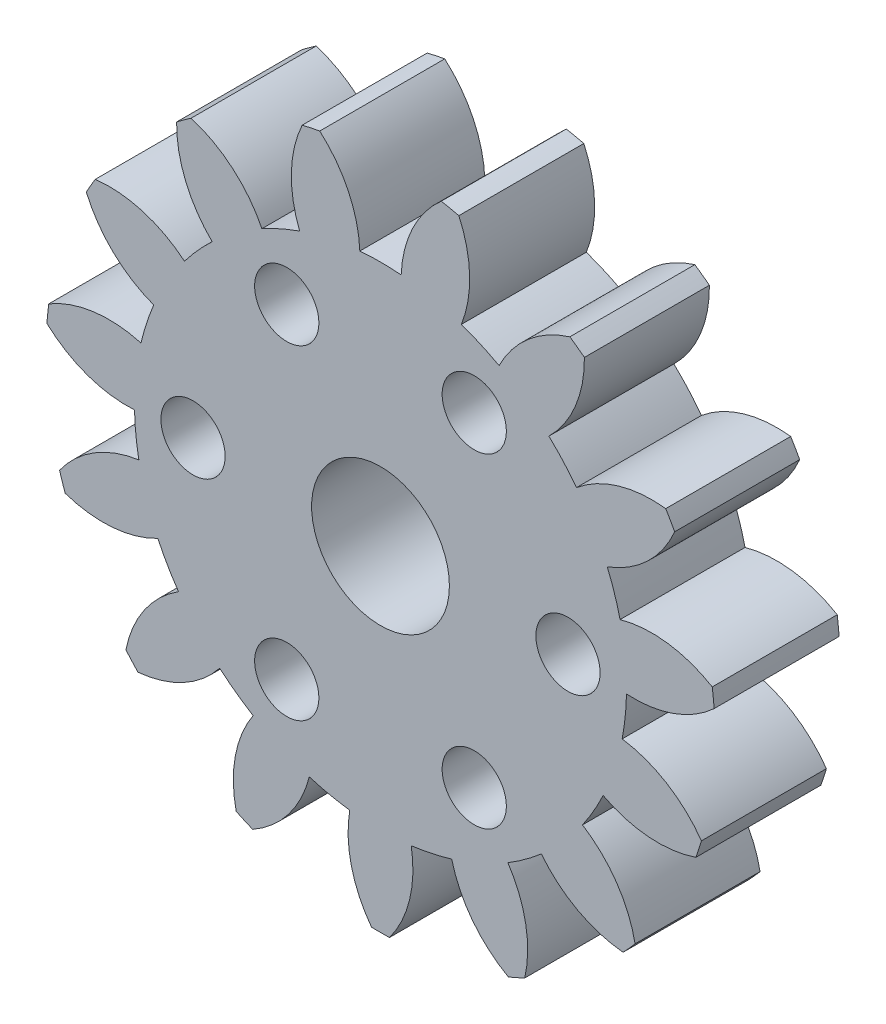
from build123d import *

# Parameters (mm, degrees)
MODEL_R             = 1.632
MODEL_R_2           = 3.5
BOSS_EXTRUDE1_DEPTH = 6.35


with BuildPart() as part:
    # Model → Boss-Extrude1 (new body)
    with BuildSketch(Plane.XY):
        with BuildLine():
            ThreePointArc((-16.948506407, 1.322168893), (-14.884445144, 0.075680968), (-12.496345641, -0.2575784))
            ThreePointArc((-12.496345641, -0.2575784), (-12.43052917, -1.306501262), (-12.276824067, -2.346186657))
            ThreePointArc((-12.276824067, -2.346186657), (-14.543449347, -3.168677314), (-16.303246508, -4.817068954))
            ThreePointArc((-16.303246508, -4.817068954), (-16.167960777, -5.253288904), (-16.021005579, -5.685717215))
            ThreePointArc((-16.021005579, -5.685717215), (-13.628399474, -5.984911247), (-11.311213223, -5.318031254))
            ThreePointArc((-11.311213223, -5.318031254), (-10.824451522, -6.2495), (-10.261156776, -7.136782372))
            ThreePointArc((-10.261156776, -7.136782372), (-11.997284916, -8.810084533), (-12.934478336, -11.031739218))
            ThreePointArc((-12.934478336, -11.031739218), (-12.633462033, -11.375220308), (-12.32332734, -11.710491163))
            ThreePointArc((-12.32332734, -11.710491163), (-10.015879724, -11.010657936), (-8.170269281, -9.458948191))
            ThreePointArc((-8.170269281, -9.458948191), (-7.346727868, -10.111903413), (-6.471242258, -10.693363579))
            ThreePointArc((-6.471242258, -10.693363579), (-7.376680931, -12.9281481), (-7.329221354, -15.338921551))
            ThreePointArc((-7.329221354, -15.338921551), (-6.914522932, -15.53027278), (-6.49483385, -15.710414802))
            ThreePointArc((-6.49483385, -15.710414802), (-4.671523379, -14.13256184), (-3.616611555, -11.964327054))
            ThreePointArc((-3.616611555, -11.964327054), (-2.598688224, -12.225866862), (-1.562391165, -12.400965077))
            ThreePointArc((-1.562391165, -12.400965077), (-1.480581798, -14.810817411), (-0.456675416, -16.993864998))
            ThreePointArc((-0.456675416, -16.993864998), (0, -17), (0.456675416, -16.993864998))
            ThreePointArc((0.456675416, -16.993864998), (1.480581798, -14.810817411), (1.562391165, -12.400965077))
            ThreePointArc((1.562391165, -12.400965077), (2.598688224, -12.225866862), (3.616611555, -11.964327054))
            ThreePointArc((3.616611555, -11.964327054), (4.671523379, -14.13256184), (6.49483385, -15.710414802))
            ThreePointArc((6.49483385, -15.710414802), (6.914522932, -15.53027278), (7.329221354, -15.338921551))
            ThreePointArc((7.329221354, -15.338921551), (7.376680931, -12.9281481), (6.471242258, -10.693363579))
            ThreePointArc((6.471242258, -10.693363579), (7.346727868, -10.111903413), (8.170269281, -9.458948191))
            ThreePointArc((8.170269281, -9.458948191), (10.015879724, -11.010657936), (12.32332734, -11.710491163))
            ThreePointArc((12.32332734, -11.710491163), (12.633462033, -11.375220308), (12.934478336, -11.031739218))
            ThreePointArc((12.934478336, -11.031739218), (11.997284916, -8.810084533), (10.261156776, -7.136782372))
            ThreePointArc((10.261156776, -7.136782372), (10.824451522, -6.2495), (11.311213223, -5.318031254))
            ThreePointArc((11.311213223, -5.318031254), (13.628399474, -5.984911247), (16.021005579, -5.685717215))
            ThreePointArc((16.021005579, -5.685717215), (16.167960777, -5.253288904), (16.303246508, -4.817068954))
            ThreePointArc((16.303246508, -4.817068954), (14.543449347, -3.168677314), (12.276824067, -2.346186657))
            ThreePointArc((12.276824067, -2.346186657), (12.43052917, -1.306501262), (12.496345641, -0.2575784))
            ThreePointArc((12.496345641, -0.2575784), (14.884445144, 0.075680968), (16.948506407, 1.322168893))
            ThreePointArc((16.948506407, 1.322168893), (16.906872221, 1.776983876), (16.853035248, 2.230516294))
            ThreePointArc((16.853035248, 2.230516294), (14.574919264, 3.020622999), (12.169716946, 2.850086045))
            ThreePointArc((12.169716946, 2.850086045), (11.887255397, 3.862403413), (11.520746371, 4.847412099))
            ThreePointArc((11.520746371, 4.847412099), (13.566835028, 6.123187257), (14.945456505, 8.101439987))
            ThreePointArc((14.945456505, 8.101439987), (14.722431864, 8.5), (14.488781088, 8.892425011))
            ThreePointArc((14.488781088, 8.892425011), (12.08625323, 8.687630155), (9.958355206, 7.553552978))
            ThreePointArc((9.958355206, 7.553552978), (9.288567174, 8.363463449), (8.553105391, 9.114241009))
            ThreePointArc((8.553105391, 9.114241009), (9.903395884, 11.111938841), (10.358201398, 13.479898509))
            ThreePointArc((10.358201398, 13.479898509), (9.992349289, 13.753288904), (9.619285053, 14.016752658))
            ThreePointArc((9.619285053, 14.016752658), (7.507764213, 12.852467132), (6.025103383, 10.950941979))
            ThreePointArc((6.025103383, 10.950941979), (5.083801302, 11.418404675), (4.106554786, 11.805134848))
            ThreePointArc((4.106554786, 11.805134848), (4.527569623, 14.179335251), (3.979919168, 16.527560117))
            ThreePointArc((3.979919168, 16.527560117), (3.534498744, 16.628509212), (3.086527243, 16.717456433))
            ThreePointArc((3.086527243, 16.717456433), (1.631114557, 14.794995781), (1.050056448, 12.454813626))
            ThreePointArc((1.050056448, 12.454813626), (0, 12.499), (-1.050056448, 12.454813626))
            ThreePointArc((-1.050056448, 12.454813626), (-1.631114557, 14.79499578), (-3.086527243, 16.717456433))
            ThreePointArc((-3.086527243, 16.717456433), (-3.534498744, 16.628509212), (-3.979919168, 16.527560117))
            ThreePointArc((-3.979919168, 16.527560117), (-4.527569623, 14.179335251), (-4.106554786, 11.805134848))
            ThreePointArc((-4.106554786, 11.805134848), (-5.083801302, 11.418404675), (-6.025103383, 10.950941979))
            ThreePointArc((-6.025103383, 10.950941979), (-7.507764213, 12.852467132), (-9.619285053, 14.016752658))
            ThreePointArc((-9.619285053, 14.016752658), (-9.992349289, 13.753288904), (-10.358201398, 13.479898509))
            ThreePointArc((-10.358201398, 13.479898509), (-9.903395884, 11.111938841), (-8.553105391, 9.114241009))
            ThreePointArc((-8.553105391, 9.114241009), (-9.288567174, 8.363463449), (-9.958355206, 7.553552978))
            ThreePointArc((-9.958355206, 7.553552978), (-12.08625323, 8.687630155), (-14.488781088, 8.892425011))
            ThreePointArc((-14.488781088, 8.892425011), (-14.722431864, 8.5), (-14.945456505, 8.101439987))
            ThreePointArc((-14.945456505, 8.101439987), (-13.566835028, 6.123187257), (-11.520746371, 4.847412099))
            ThreePointArc((-11.520746371, 4.847412099), (-11.887255397, 3.862403413), (-12.169716946, 2.850086045))
            ThreePointArc((-12.169716946, 2.850086045), (-14.574919264, 3.020622999), (-16.853035248, 2.230516294))
            ThreePointArc((-16.853035248, 2.230516294), (-16.906872221, 1.776983876), (-16.948506407, 1.322168893))
        make_face()
        with Locations((-4.7625, -8.248891971)):
            Circle(MODEL_R, mode=Mode.SUBTRACT)
        with Locations((4.7625, -8.248891971)):
            Circle(MODEL_R, mode=Mode.SUBTRACT)
        with Locations((9.525, 0)):
            Circle(MODEL_R, mode=Mode.SUBTRACT)
        with Locations((4.7625, 8.248891971)):
            Circle(MODEL_R, mode=Mode.SUBTRACT)
        with Locations((-4.7625, 8.248891971)):
            Circle(MODEL_R, mode=Mode.SUBTRACT)
        with Locations((-9.525, 0)):
            Circle(MODEL_R, mode=Mode.SUBTRACT)
        Circle(MODEL_R_2, mode=Mode.SUBTRACT)
    extrude(amount=BOSS_EXTRUDE1_DEPTH)


solid = part.part
